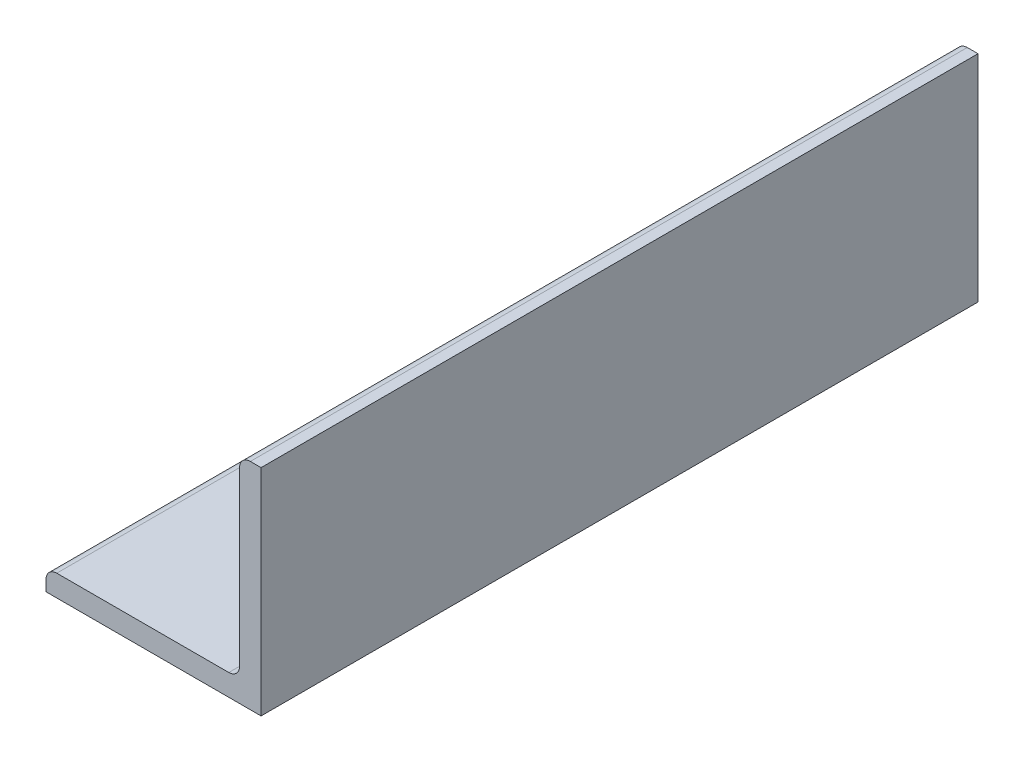
from build123d import *

# Parameters (mm, degrees)
BOSS_EXTRUDE1_DEPTH = 100


with BuildPart() as part:
    # Sketch1 → Boss-Extrude1 (new body)
    with BuildSketch(Plane.XY):
        with BuildLine():
            Line((-135.600940307, 27), (-135.600940307, -3))
            Line((-135.600940307, -3), (-165.600940307, -3))
            Line((-165.600940307, -3), (-165.600940307, -1.5))
            ThreePointArc((-165.600940307, -1.5), (-165.161600478, -0.439339828), (-164.100940307, 0))
            Line((-164.100940307, 0), (-140.100940307, 0))
            ThreePointArc((-140.100940307, 0), (-139.040280135, 0.439339828), (-138.600940307, 1.5))
            Line((-138.600940307, 1.5), (-138.600940307, 25.5))
            ThreePointArc((-138.600940307, 25.5), (-138.161600478, 26.560660172), (-137.100940307, 27))
            Line((-137.100940307, 27), (-135.600940307, 27))
        make_face()
    extrude(amount=BOSS_EXTRUDE1_DEPTH)


solid = part.part
